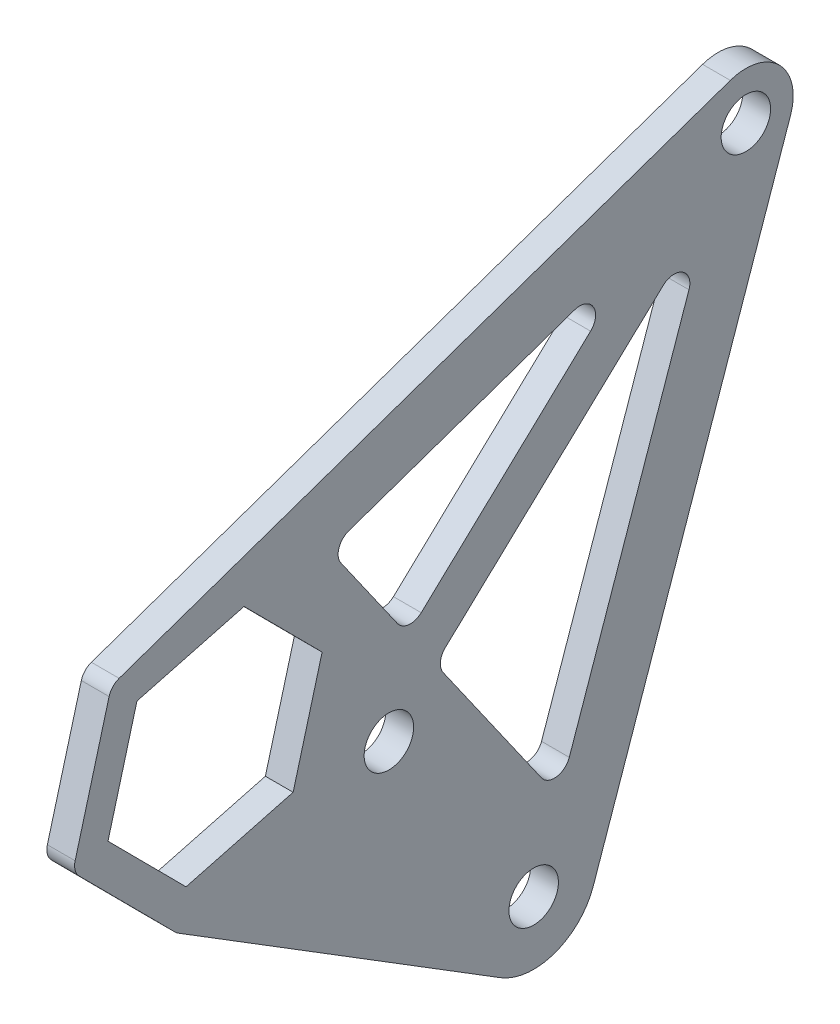
from build123d import *

# Parameters (mm, degrees)
SKETCH1_R           = 2.4892
BOSS_EXTRUDE1_DEPTH = 2.794
CUT_EXTRUDE1_DEPTH  = 76.982993088
BOSS_EXTRUDE2_START = -2.794
BOSS_EXTRUDE2_DEPTH = 2.794
CUT_EXTRUDE2_DEPTH  = 93.595404272
FILLET1_R           = 1.5875
FILLET2_R           = 1.5875


with BuildPart() as part:
    # Sketch1 → Boss-Extrude1 (new body)
    with BuildSketch(Plane(origin=(0, 0, 0), x_dir=(0, 0, -1), z_dir=(1, 0, 0))):
        with BuildLine():
            Line((-15.352682977, -58.807991027), (4.499625018, -1.560378463))
            ThreePointArc((4.499625018, -1.560378463), (2.590924963, 3.996062323), (-3.260713933, 3.471188686))
            Line((-3.260713933, 3.471188686), (-40.268643062, -31.292772903))
            ThreePointArc((-40.268643062, -31.292772903), (-42.237439845, -35.268799833), (-41.122639966, -39.563234855))
            Line((-41.122639966, -39.563234855), (-26.553798482, -60.36969678))
            ThreePointArc((-26.553798482, -60.36969678), (-20.475321466, -63.016652797), (-15.352682977, -58.807991027))
        make_face()
        Circle(SKETCH1_R, mode=Mode.SUBTRACT)
        with Locations((-35.921024484, -35.921024484)):
            Circle(SKETCH1_R, mode=Mode.SUBTRACT)
        with Locations((-21.352183001, -56.727486409)):
            Circle(SKETCH1_R, mode=Mode.SUBTRACT)
    extrude(amount=BOSS_EXTRUDE1_DEPTH)

    # Sketch2 → Cut-Extrude1 (cut, through all)
    with BuildSketch(Plane(origin=(2.794, 0, 0), x_dir=(0, 0, -1), z_dir=(1, 0, 0))):
        Polygon((-3.612253937, -5.571289043), (-31.24485752, -31.528395862), (-18.784617945, -49.323462173), align=None)
    extrude(amount=-CUT_EXTRUDE1_DEPTH, mode=Mode.SUBTRACT)

    # Sketch3 → Boss-Extrude2 (add)
    with BuildSketch(Plane(origin=(2.794, 0, 0), x_dir=(0, 0, -1), z_dir=(1, 0, 0)).offset(BOSS_EXTRUDE2_START)):
        with BuildLine():
            Line((-1.562121869, 4.499020062), (-63.85396467, -17.129567629))
            Line((-63.85396467, -17.129567629), (-67.729854308, -31.424790078))
            Line((-67.729854308, -31.424790078), (-57.287773334, -41.92902019))
            Line((-57.287773334, -41.92902019), (-24.697034781, -62.125121685))
            ThreePointArc((-24.697034781, -62.125121685), (-25.714625529, -61.341768064), (-26.553798482, -60.36969678))
            Line((-26.553798482, -60.36969678), (-41.122639966, -39.563234855))
            ThreePointArc((-41.122639966, -39.563234855), (-42.237439845, -35.268799833), (-40.268643062, -31.292772903))
            Line((-40.268643062, -31.292772903), (-3.260713933, 3.471188686))
            ThreePointArc((-3.260713933, 3.471188686), (-2.465572069, 4.074599443), (-1.562121869, 4.499020062))
        make_face()
        Polygon((-56.32839471, -38.390598792), (-45.55447623, -35.537970896), (-42.637965216, -24.781169846), (-50.495372681, -16.876996692), (-61.269291162, -19.729624588), (-64.185802176, -30.486425638), align=None, mode=Mode.SUBTRACT)
    extrude(amount=BOSS_EXTRUDE2_DEPTH)

    # Sketch4 → Cut-Extrude2 (cut, through all)
    with BuildSketch(Plane(origin=(2.794, 0, 0), x_dir=(0, 0, -1), z_dir=(1, 0, 0))):
        Polygon((-41.946495802, -16.24487248), (-34.004795616, -27.58679577), (-10.194346511, -5.220087943), align=None)
    extrude(amount=-CUT_EXTRUDE2_DEPTH, mode=Mode.SUBTRACT)

    # Fillet1
    fillet1_edges = [part.edges().sort_by_distance(p)[0] for p in [
        (1.397, -5.571289043, 3.612253937),
        (1.397, -49.323462173, 18.784617945),
        (1.397, -31.528395862, 31.24485752),
    ]]
    fillet(fillet1_edges, radius=FILLET1_R)

    # Fillet2
    fillet2_edges = [part.edges().sort_by_distance(p)[0] for p in [
        (1.397, -17.129567629, 63.85396467),
        (1.397, -31.424790078, 67.729854308),
        (1.397, -41.92902019, 57.287773334),
        (1.397, -16.24487248, 41.946495802),
        (1.397, -5.220087943, 10.194346511),
        (1.397, -27.58679577, 34.004795616),
    ]]
    fillet(fillet2_edges, radius=FILLET2_R)


solid = part.part
